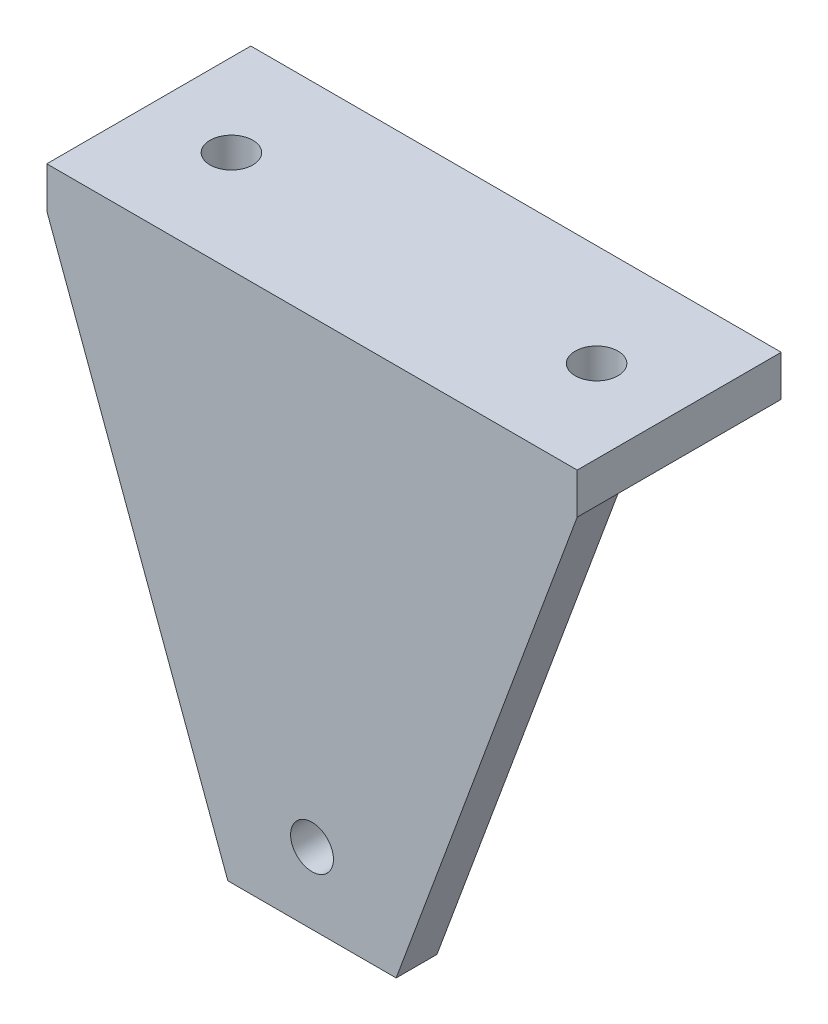
from build123d import *

# Parameters (mm, degrees)
SKETCH1_W           = 52
SKETCH1_H           = 20
SKETCH1_R           = 2.1
BOSS_EXTRUDE1_DEPTH = 4
SKETCH2_W           = 52
SKETCH2_H           = 4
BOSS_EXTRUDE2_DEPTH = 48
CUT_EXTRUDE1_REACH  = 75.539
SKETCH3_R           = 2.1
BOSS_EXTRUDE3_DEPTH = 16
CUT_EXTRUDE3_DEPTH  = 74.539105243


with BuildPart() as part:
    # Sketch1 → Boss-Extrude1 (new body)
    with BuildSketch(Plane(origin=(0, 0, 0), x_dir=(1, 0, 0), z_dir=(0, 1, 0))):
        with Locations((26, 10)):
            Rectangle(SKETCH1_W, SKETCH1_H)
        with Locations(Location((43.9, 10, 0), (0, 0, 270))):
            Circle(SKETCH1_R, mode=Mode.SUBTRACT)
        with Locations(Location((8.1, 10, 0), (0, 0, 90))):
            Circle(SKETCH1_R, mode=Mode.SUBTRACT)
    extrude(amount=BOSS_EXTRUDE1_DEPTH)

    # Sketch2 → Boss-Extrude2 (add)
    with BuildSketch(Plane.XZ):
        with Locations((26, -2)):
            Rectangle(SKETCH2_W, SKETCH2_H)
    extrude(amount=BOSS_EXTRUDE2_DEPTH)

    # Sketch3 → Cut-Extrude1 (cut, up to next)
    with BuildSketch(Plane.XY, mode=Mode.PRIVATE) as cut_extrude1_sk1:
        with Locations((26, -41)):
            Circle(SKETCH3_R)
    cut_extrude1_tool1 = extrude(cut_extrude1_sk1.sketch, amount=-CUT_EXTRUDE1_REACH, mode=Mode.PRIVATE) & part.part
    # Sketch3 → Cut-Extrude1 (cut, up to next)
    with BuildSketch(Plane.XY, mode=Mode.PRIVATE) as cut_extrude1_sk2:
        Polygon((52, 0), (34.25, -48), (52, -48), align=None)
    cut_extrude1_tool2 = extrude(cut_extrude1_sk2.sketch, amount=-CUT_EXTRUDE1_REACH, mode=Mode.PRIVATE) & part.part
    # Sketch3 → Cut-Extrude1 (cut, up to next)
    with BuildSketch(Plane.XY, mode=Mode.PRIVATE) as cut_extrude1_sk3:
        Polygon((0, -48), (0, 0), (17.75, -48), align=None)
    cut_extrude1_tool3 = extrude(cut_extrude1_sk3.sketch, amount=-CUT_EXTRUDE1_REACH, mode=Mode.PRIVATE) & part.part
    add(cut_extrude1_tool1.solids().sort_by_distance((26, -41, 0))[0], mode=Mode.SUBTRACT)
    add(cut_extrude1_tool2.solids().sort_by_distance((46.083333, -32, 0))[0], mode=Mode.SUBTRACT)
    add(cut_extrude1_tool3.solids().sort_by_distance((5.916667, -32, 0))[0], mode=Mode.SUBTRACT)

    # Sketch5 → Boss-Extrude3 (add)
    with BuildSketch(Plane(origin=(0, 0, -4), x_dir=(-1, 0, 0), z_dir=(0, 0, -1))):
        Polygon((-34.25, -48), (-38.012268219, 0), (-34, 0), (-30.237731781, -48), align=None)
        Polygon((-13.987731781, 0), (-18, 0), (-21.762268219, -48), (-17.75, -48), align=None)
    extrude(amount=BOSS_EXTRUDE3_DEPTH)

    # Sketch6 → Cut-Extrude3 (cut, through all)
    with BuildSketch(Plane.ZY):
        Polygon((-20, 0), (-4, -48), (-20, -48), align=None)
    extrude(amount=-CUT_EXTRUDE3_DEPTH, mode=Mode.SUBTRACT)


solid = part.part
